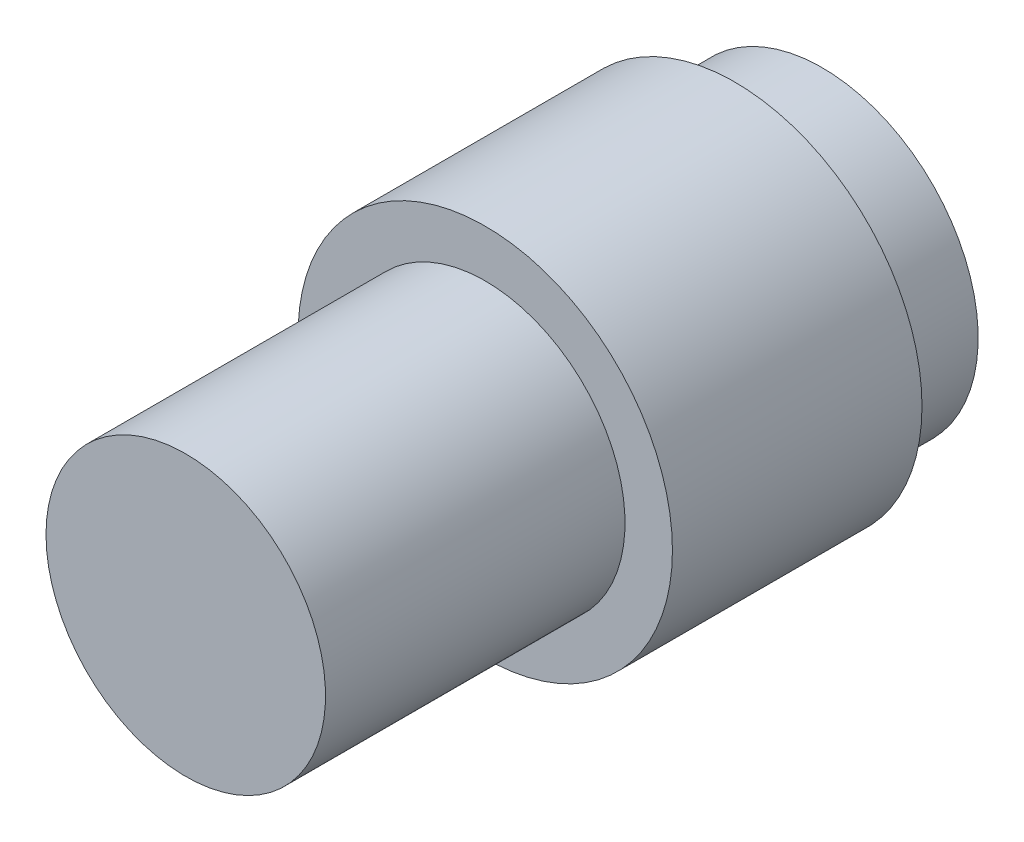
from build123d import *

# Parameters (mm, degrees)
SKETCH1_R           = 1.905
BOSS_EXTRUDE1_DEPTH = 2.54
SKETCH2_R           = 1.4224
BOSS_EXTRUDE2_DEPTH = 3.048
SKETCH3_R           = 1.5875
BOSS_EXTRUDE3_DEPTH = 0.889


with BuildPart() as part:
    # Sketch1 → Boss-Extrude1 (new body)
    with BuildSketch(Plane.XY):
        Circle(SKETCH1_R)
    extrude(amount=BOSS_EXTRUDE1_DEPTH)

    # Sketch2 → Boss-Extrude2 (add)
    with BuildSketch(Plane.XY.offset(2.54)):
        with Locations(Location((0, 0, 0), (0, 0, 180))):
            Circle(SKETCH2_R)
    extrude(amount=BOSS_EXTRUDE2_DEPTH)

    # Sketch3 → Boss-Extrude3 (add)
    with BuildSketch(Plane(origin=(0, 0, 0), x_dir=(-1, 0, 0), z_dir=(0, 0, -1))):
        Circle(SKETCH3_R)
    extrude(amount=BOSS_EXTRUDE3_DEPTH)


solid = part.part
